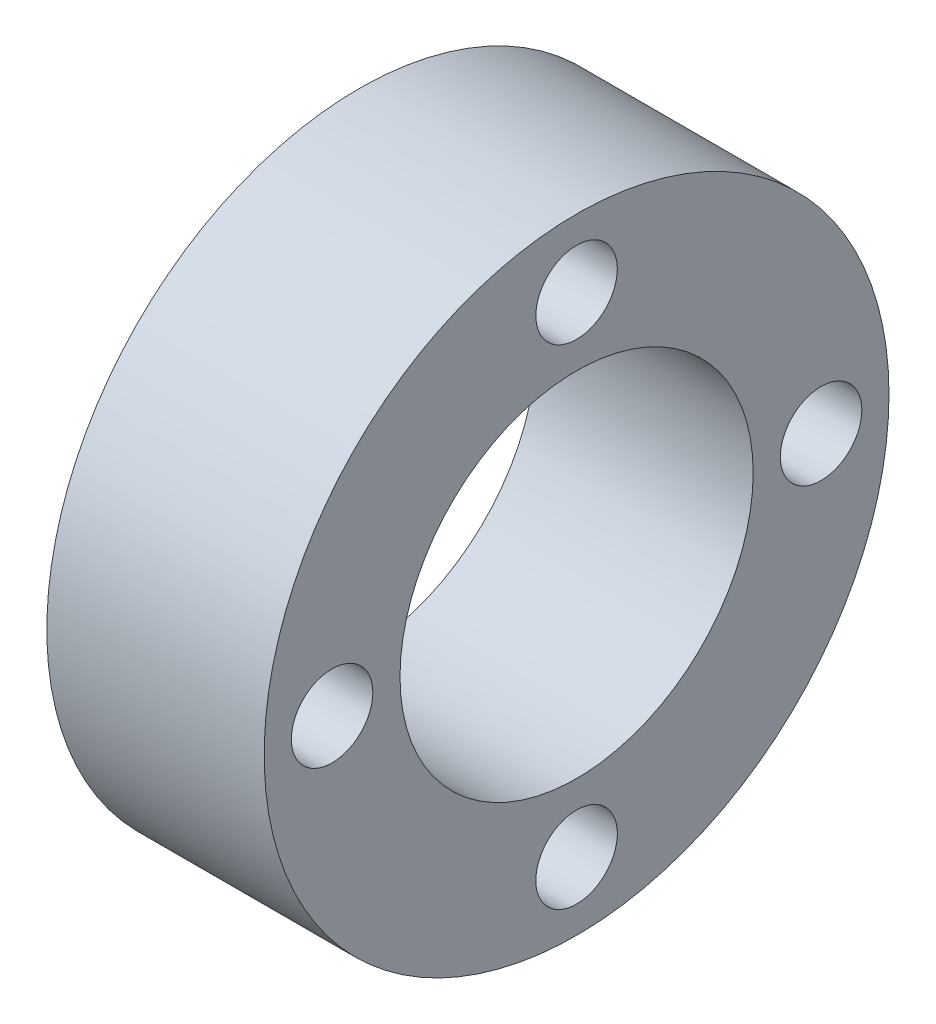
from build123d import *

# Parameters (mm, degrees)
SKETCH_1_R               = 11.5
SKETCH_1_R_2             = 6.5
EXTRUDE_1_DEPTH          = 8
SKETCH_2_R               = 1.5
CUT_EXTRUDE_2_DEPTH      = 3
PATTERN_CIRCULAR_1_COUNT = 4


with BuildPart() as part:
    # 草图1 → 拉伸1 (new body)
    with BuildSketch(Plane(origin=(0, 0, 0), x_dir=(0, 0, -1), z_dir=(1, 0, 0))):
        Circle(SKETCH_1_R)
        Circle(SKETCH_1_R_2, mode=Mode.SUBTRACT)
    extrude(amount=EXTRUDE_1_DEPTH)

    # 草图2 → 拉伸2 (cut)
    with BuildSketch(Plane(origin=(8, 0, 0), x_dir=(0, 0, -1), z_dir=(1, 0, 0))):
        with Locations((0, 9)):
            Circle(SKETCH_2_R)
    cut_extrude_2 = extrude(amount=-CUT_EXTRUDE_2_DEPTH, mode=Mode.SUBTRACT)

    # 阵列(圆周)1: 拉伸2 ×4 about axis
    pattern_circular_1_axis = Axis((0, 0, 0), (1, 0, 0))
    for i in range(1, PATTERN_CIRCULAR_1_COUNT):
        add(cut_extrude_2.rotate(pattern_circular_1_axis, i * 360 / PATTERN_CIRCULAR_1_COUNT), mode=Mode.SUBTRACT)


solid = part.part
